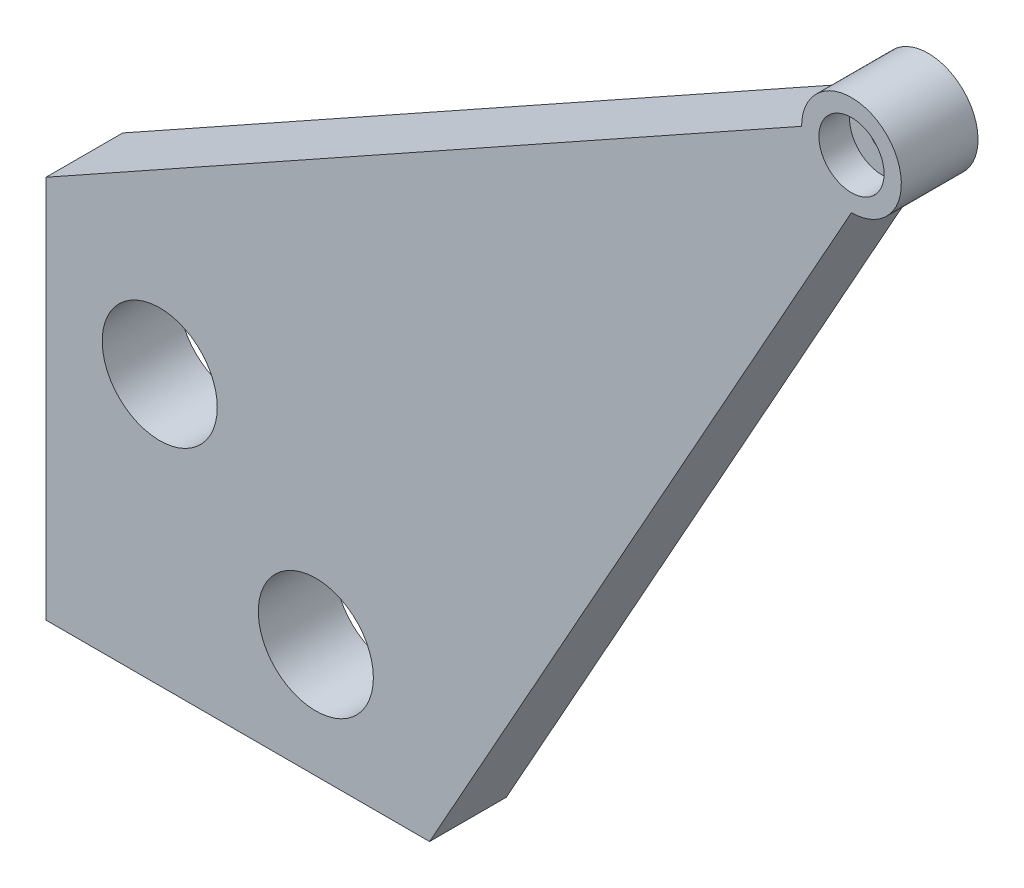
from build123d import *

# Parameters (mm, degrees)
RESSALTO_EXTRUS_O2_DEPTH = 5
ESBO_O4_R                = 4.25
CORTE_EXTRUS_O1_DEPTH    = 4
ESBO_O5_R                = 1.5
CORTE_EXTRUS_O2_DEPTH    = 158.798922683
ESBO_O6_R                = 7.5
CORTE_EXTRUS_O3_DEPTH    = 159.001582271


with BuildPart() as part:
    # Esboço3 → Ressalto-extrusão2 (new, symmetric)
    with BuildSketch(Plane.XY):
        with BuildLine():
            Line((0, 50), (98.5, 105))
            ThreePointArc((98.5, 105), (109.596194078, 109.596194078), (105, 98.5))
            Line((105, 98.5), (50, 0))
            Line((50, 0), (0, 0))
            Line((0, 0), (0, 50))
        make_face()
    extrude(amount=RESSALTO_EXTRUS_O2_DEPTH, both=True)

    # Esboço4 → Corte-extrusão1 (cut)
    with BuildSketch(Plane.XY.offset(5)):
        with Locations((105, 105)):
            Circle(ESBO_O4_R)
    extrude(amount=-CORTE_EXTRUS_O1_DEPTH, mode=Mode.SUBTRACT)

    # Esboço5 → Corte-extrusão2 (cut, through all)
    with BuildSketch(Plane.XY.offset(1)):
        with Locations((105, 105)):
            Circle(ESBO_O5_R)
    extrude(amount=-CORTE_EXTRUS_O2_DEPTH, mode=Mode.SUBTRACT)

    # Esboço6 → Corte-extrusão3 (cut, through all)
    with BuildSketch(Plane.XY.offset(5)):
        with Locations((14.825558834, 35.174441166)):
            Circle(ESBO_O6_R)
        with Locations((35.174441166, 14.825558834)):
            Circle(ESBO_O6_R)
    extrude(amount=-CORTE_EXTRUS_O3_DEPTH, mode=Mode.SUBTRACT)


solid = part.part
